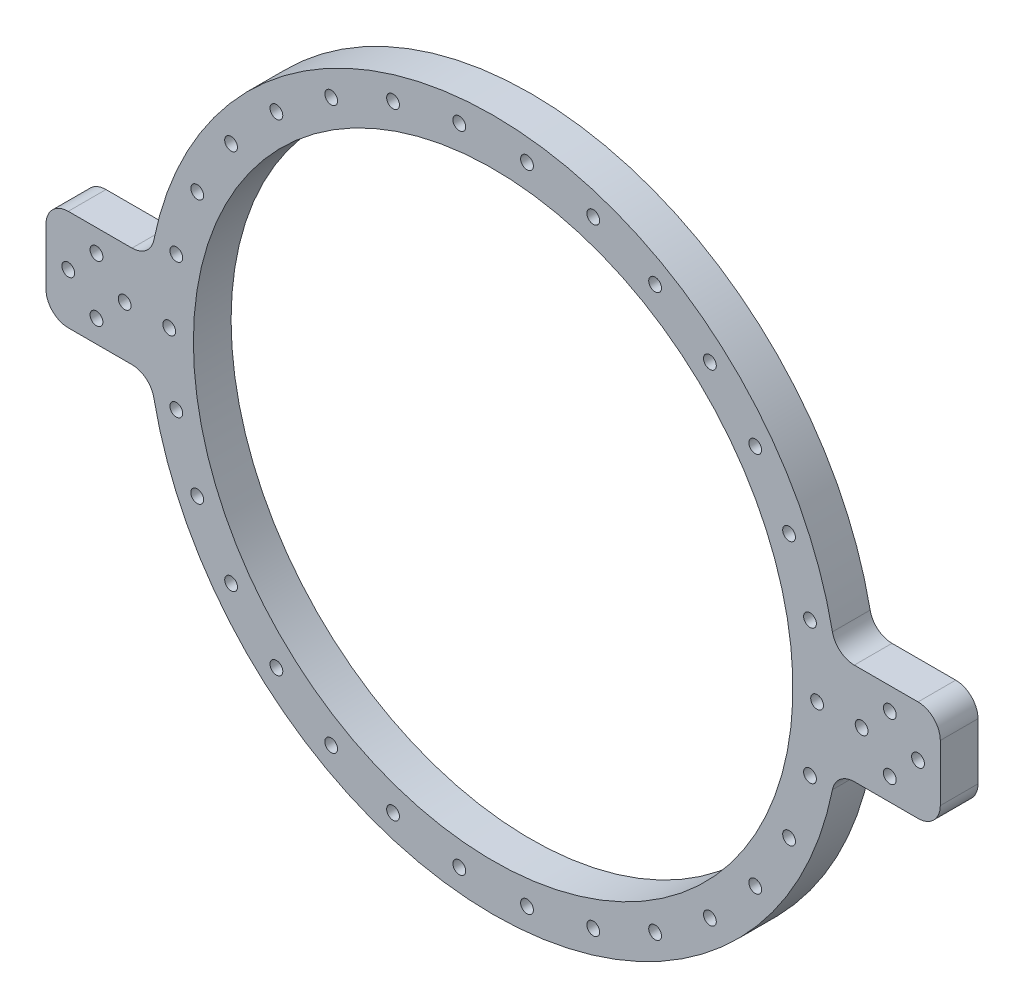
from build123d import *

# Parameters (mm, degrees)
SKETCH1_R           = 101.6
SKETCH1_R_2         = 2.15265
SKETCH1_R_3         = 2.1525
BOSS_EXTRUDE1_DEPTH = 12.7
FILLET1_R           = 7.5
SKETCH2_R           = 101.6
SKETCH2_R_2         = 100.965
BOSS_EXTRUDE3_DEPTH = 12.7


with BuildPart() as part:
    # Sketch1 → Boss-Extrude1 (new body)
    with BuildSketch(Plane.XY):
        with BuildLine():
            Line((115.326459663, 17), (143.1, 17))
            ThreePointArc((143.1, 17), (148.403300859, 14.803300859), (150.6, 9.5))
            Line((150.6, 9.5), (150.6, -9.5))
            ThreePointArc((150.6, -9.5), (148.403300859, -14.803300859), (143.1, -17))
            Line((143.1, -17), (115.326459663, -17))
            ThreePointArc((115.326459663, -17), (0, -116.572691049), (-115.326459663, -17))
            Line((-115.326459663, -17), (-143.1, -17))
            ThreePointArc((-143.1, -17), (-148.403300859, -14.803300859), (-150.6, -9.5))
            Line((-150.6, -9.5), (-150.6, 9.5))
            ThreePointArc((-150.6, 9.5), (-148.403300859, 14.803300859), (-143.1, 17))
            Line((-143.1, 17), (-115.326459663, 17))
            ThreePointArc((-115.326459663, 17), (0, 116.572691049), (115.326459663, 17))
        make_face()
        Circle(SKETCH1_R, mode=Mode.SUBTRACT)
        with Locations((109.1, 0)):
            Circle(SKETCH1_R_2, mode=Mode.SUBTRACT)
        with Locations((106.71590324, -22.683165468)):
            Circle(SKETCH1_R_2, mode=Mode.SUBTRACT)
        with Locations((99.667809429, -44.37496776)):
            Circle(SKETCH1_R_2, mode=Mode.SUBTRACT)
        with Locations((88.263754086, -64.127371025)):
            Circle(SKETCH1_R_2, mode=Mode.SUBTRACT)
        with Locations((73.002149154, -81.07710046)):
            Circle(SKETCH1_R_2, mode=Mode.SUBTRACT)
        with Locations((54.55, -94.483371553)):
            Circle(SKETCH1_R_2, mode=Mode.SUBTRACT)
        with Locations((33.713754086, -103.760265928)):
            Circle(SKETCH1_R_2, mode=Mode.SUBTRACT)
        with Locations((11.404055343, -108.502338785)):
            Circle(SKETCH1_R_2, mode=Mode.SUBTRACT)
        with Locations((-11.404055343, -108.502338785)):
            Circle(SKETCH1_R_2, mode=Mode.SUBTRACT)
        with Locations((-33.713754086, -103.760265928)):
            Circle(SKETCH1_R_2, mode=Mode.SUBTRACT)
        with Locations((-54.55, -94.483371553)):
            Circle(SKETCH1_R_2, mode=Mode.SUBTRACT)
        with Locations((-73.002149154, -81.07710046)):
            Circle(SKETCH1_R_2, mode=Mode.SUBTRACT)
        with Locations((-88.263754086, -64.127371025)):
            Circle(SKETCH1_R_2, mode=Mode.SUBTRACT)
        with Locations((-99.667809429, -44.37496776)):
            Circle(SKETCH1_R_2, mode=Mode.SUBTRACT)
        with Locations((-106.71590324, -22.683165468)):
            Circle(SKETCH1_R_2, mode=Mode.SUBTRACT)
        with Locations((-109.1, 0)):
            Circle(SKETCH1_R_2, mode=Mode.SUBTRACT)
        with Locations((-106.71590324, 22.683165468)):
            Circle(SKETCH1_R_2, mode=Mode.SUBTRACT)
        with Locations((-99.667809429, 44.37496776)):
            Circle(SKETCH1_R_2, mode=Mode.SUBTRACT)
        with Locations((-88.263754086, 64.127371025)):
            Circle(SKETCH1_R_2, mode=Mode.SUBTRACT)
        with Locations((-73.002149154, 81.07710046)):
            Circle(SKETCH1_R_2, mode=Mode.SUBTRACT)
        with Locations((-54.55, 94.483371553)):
            Circle(SKETCH1_R_2, mode=Mode.SUBTRACT)
        with Locations((-33.713754086, 103.760265928)):
            Circle(SKETCH1_R_2, mode=Mode.SUBTRACT)
        with Locations((-11.404055343, 108.502338785)):
            Circle(SKETCH1_R_2, mode=Mode.SUBTRACT)
        with Locations((11.404055343, 108.502338785)):
            Circle(SKETCH1_R_2, mode=Mode.SUBTRACT)
        with Locations((33.713754086, 103.760265928)):
            Circle(SKETCH1_R_2, mode=Mode.SUBTRACT)
        with Locations((54.55, 94.483371553)):
            Circle(SKETCH1_R_2, mode=Mode.SUBTRACT)
        with Locations((73.002149154, 81.07710046)):
            Circle(SKETCH1_R_2, mode=Mode.SUBTRACT)
        with Locations((88.263754086, 64.127371025)):
            Circle(SKETCH1_R_2, mode=Mode.SUBTRACT)
        with Locations((99.667809429, 44.37496776)):
            Circle(SKETCH1_R_2, mode=Mode.SUBTRACT)
        with Locations((106.71590324, 22.683165468)):
            Circle(SKETCH1_R_2, mode=Mode.SUBTRACT)
        with Locations((133.6, 9.5)):
            Circle(SKETCH1_R_3, mode=Mode.SUBTRACT)
        with Locations((133.6, -9.5)):
            Circle(SKETCH1_R_3, mode=Mode.SUBTRACT)
        with Locations((143.1, 0)):
            Circle(SKETCH1_R_3, mode=Mode.SUBTRACT)
        with Locations((124.1, 0)):
            Circle(SKETCH1_R_3, mode=Mode.SUBTRACT)
        with Locations(Location((-143.1, 0, 0), (0, 0, 180))):
            Circle(SKETCH1_R_3, mode=Mode.SUBTRACT)
        with Locations(Location((-133.6, -9.5, 0), (0, 0, 180))):
            Circle(SKETCH1_R_3, mode=Mode.SUBTRACT)
        with Locations(Location((-124.1, 0, 0), (0, 0, 180))):
            Circle(SKETCH1_R_3, mode=Mode.SUBTRACT)
        with Locations(Location((-133.6, 9.5, 0), (0, 0, 180))):
            Circle(SKETCH1_R_3, mode=Mode.SUBTRACT)
    extrude(amount=BOSS_EXTRUDE1_DEPTH)

    # Fillet1
    fillet1_edges = [part.edges().sort_by_distance(p)[0] for p in [
        (115.326459663, 17, 6.35),
        (115.326459663, -17, 6.35),
        (-115.326459663, -17, 6.35),
        (-115.326459663, 17, 6.35),
    ]]
    fillet(fillet1_edges, radius=FILLET1_R)

    # Sketch2 → Boss-Extrude3 (add)
    with BuildSketch(Plane(origin=(0, 0, 0), x_dir=(-1, 0, 0), z_dir=(0, 0, -1))):
        Circle(SKETCH2_R)
        Circle(SKETCH2_R_2, mode=Mode.SUBTRACT)
    extrude(amount=-BOSS_EXTRUDE3_DEPTH)


solid = part.part
